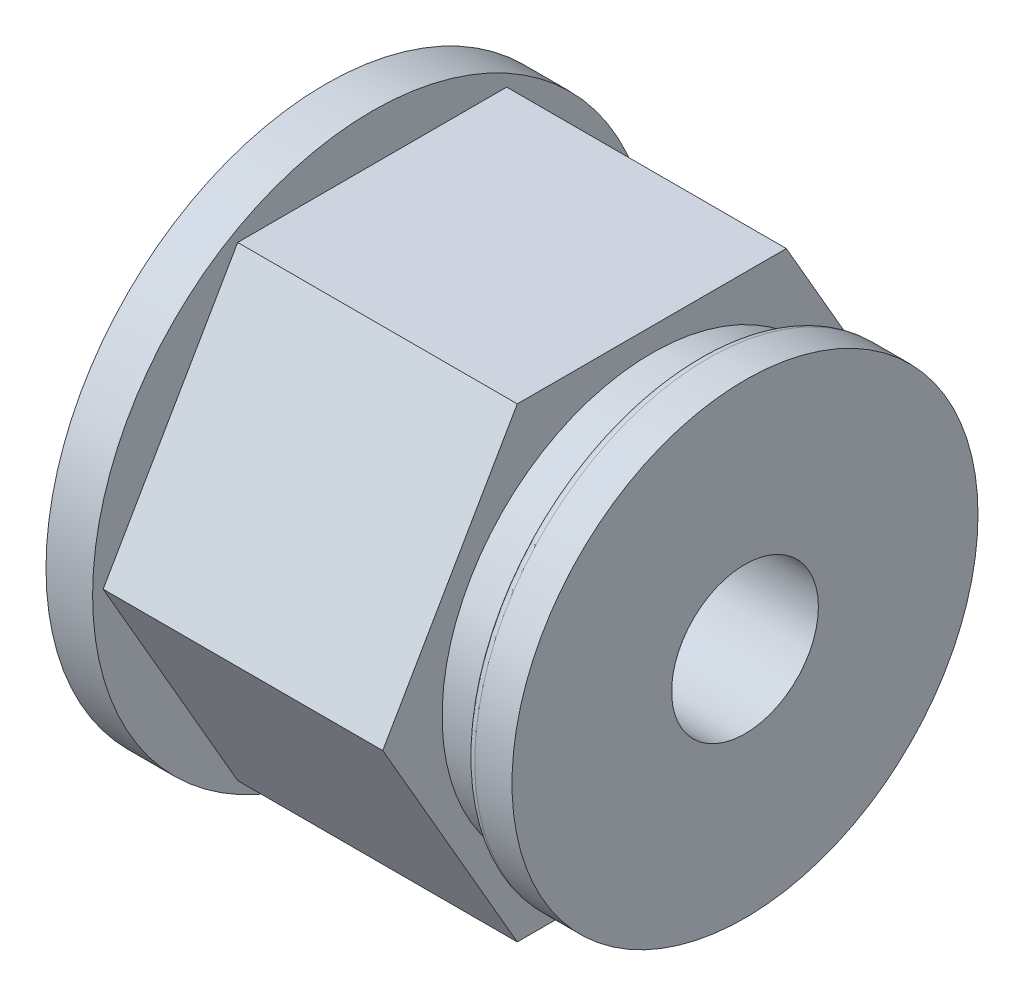
from build123d import *

# Parameters (mm, degrees)
SKETCH2_R           = 7.62
BOSS_EXTRUDE1_DEPTH = 1.27
BOSS_EXTRUDE2_DEPTH = 7.62
SKETCH4_R           = 5.715
BOSS_EXTRUDE3_DEPTH = 1.27
SKETCH5_R           = 6.35
BOSS_EXTRUDE4_DEPTH = 1.27
FILLET1_R           = 0.254
SKETCH6_R           = 2
CUT_EXTRUDE1_DEPTH  = 11.43


with BuildPart() as part:
    # Sketch2 → Boss-Extrude1 (new body)
    with BuildSketch(Plane(origin=(0, 0, 0), x_dir=(0, 0, -1), z_dir=(1, 0, 0))):
        Circle(SKETCH2_R)
    extrude(amount=-BOSS_EXTRUDE1_DEPTH)

    # Sketch3 → Boss-Extrude2 (add)
    with BuildSketch(Plane(origin=(0, 0, 0), x_dir=(0, 0, -1), z_dir=(1, 0, 0))):
        Polygon((-3.666174209, 6.35), (-7.332348419, 0), (-3.666174209, -6.35), (3.666174209, -6.35), (7.332348419, 0), (3.666174209, 6.35), align=None)
    extrude(amount=BOSS_EXTRUDE2_DEPTH)

    # Sketch4 → Boss-Extrude3 (add)
    with BuildSketch(Plane(origin=(7.62, 0, 0), x_dir=(0, 0, -1), z_dir=(1, 0, 0))):
        Circle(SKETCH4_R)
    extrude(amount=BOSS_EXTRUDE3_DEPTH)

    # Sketch5 → Boss-Extrude4 (add)
    with BuildSketch(Plane(origin=(8.89, 0, 0), x_dir=(0, 0, -1), z_dir=(1, 0, 0))):
        Circle(SKETCH5_R)
    extrude(amount=BOSS_EXTRUDE4_DEPTH)

    # Fillet1
    fillet1_edges = [part.edges().sort_by_distance(p)[0] for p in [
        (8.89, 0, 5.715),
        (8.89, 0, 6.35),
    ]]
    fillet(fillet1_edges, radius=FILLET1_R)

    # Sketch6 → Cut-Extrude1 (cut)
    with BuildSketch(Plane(origin=(10.16, 0, 0), x_dir=(0, 0, -1), z_dir=(1, 0, 0))):
        Circle(SKETCH6_R)
    extrude(amount=-CUT_EXTRUDE1_DEPTH, mode=Mode.SUBTRACT)


solid = part.part
